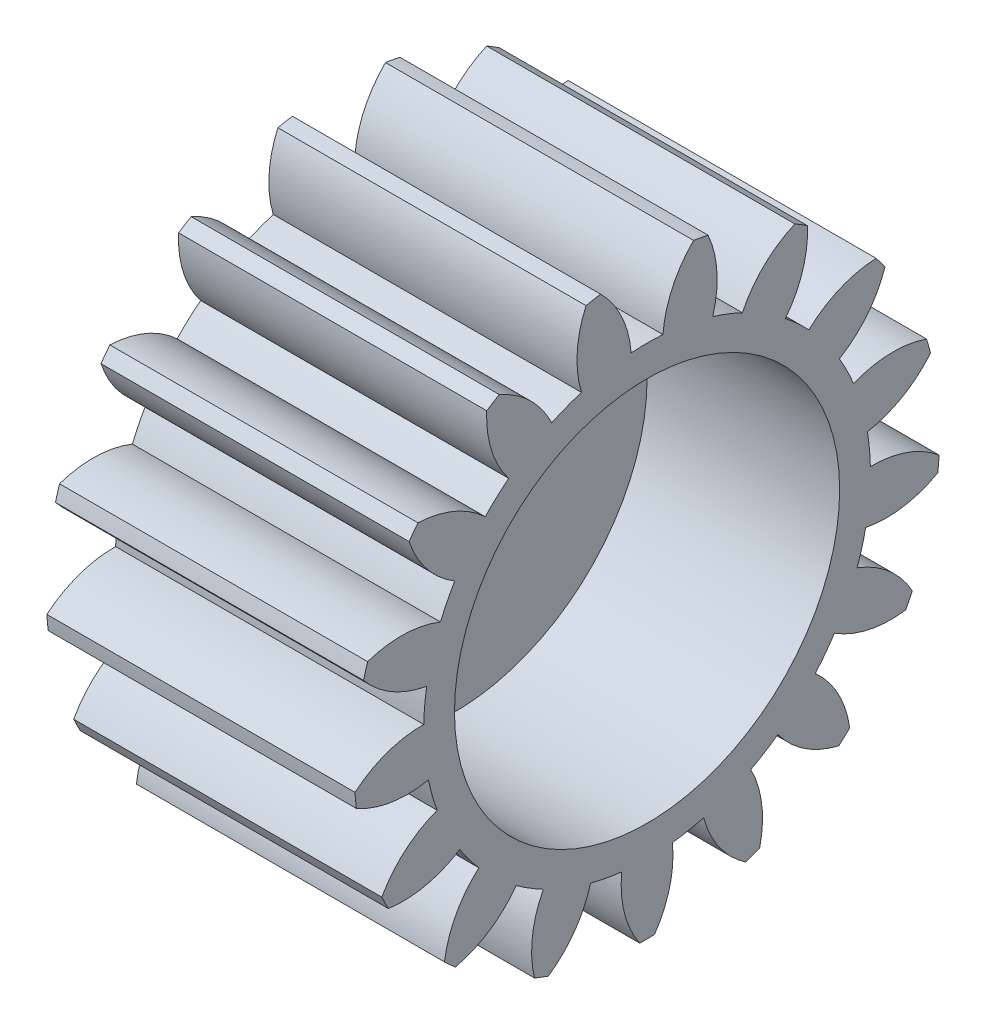
from build123d import *

# Parameters (mm, degrees)
BASPROSKE_W         = 8
BASPROSKE_H         = 7.6
TOOTHCUT_DEPTH      = 14.39850738
TEETHCUTS_COUNT     = 17
TEETHCUTS_ANGLE     = 338.823529412
BORSKE_R            = 5
BORE_DEPTH          = 50.0000508
BOSS_EXTRUDE1_START = -3
SKETCH1_R           = 5
BOSS_EXTRUDE1_DEPTH = 3


with BuildPart() as part:
    # BasProSke → Base-Revolve (revolve)
    with BuildSketch(Plane(origin=(0, 0, 0), x_dir=(1, 0, 0), z_dir=(0, 1, 0)), mode=Mode.PRIVATE) as base_revolve_sk:
        with Locations((4, 3.8)):
            Rectangle(BASPROSKE_W, BASPROSKE_H)
    revolve(base_revolve_sk.sketch.rotate(Axis((-10, 0, 0), (1, 0, 0)), 180), axis=Axis((-10, 0, 0), (1, 0, 0)))

    # TooCutSke → ToothCut (cut, through all)
    with BuildSketch(Plane(origin=(0, 0, 0), x_dir=(0, 0, -1), z_dir=(1, 0, 0))):
        with BuildLine():
            ThreePointArc((0.412875903, 5.784283403), (0, 5.799), (-0.412875903, 5.784283403))
            ThreePointArc((-0.412875903, 5.784283403), (-0.662486036, 6.729558143), (-1.230208712, 7.525510726))
            ThreePointArc((-1.230208712, 7.525510726), (0, 7.6254), (1.230208712, 7.525510726))
            ThreePointArc((1.230208712, 7.525510726), (0.662486036, 6.729558143), (0.412875903, 5.784283403))
        make_face()
    toothcut = extrude(amount=TOOTHCUT_DEPTH, mode=Mode.SUBTRACT)

    # TeethCuts: ToothCut ×17 about axis
    teethcuts_axis = Axis((-10, 0, 0), (1, 0, 0))
    for i in range(1, TEETHCUTS_COUNT):
        add(toothcut.rotate(teethcuts_axis, i * TEETHCUTS_ANGLE / (TEETHCUTS_COUNT - 1)), mode=Mode.SUBTRACT)

    # BorSke → Bore (cut, symmetric)
    with BuildSketch(Plane(origin=(0, 0, 0), x_dir=(0, 0, -1), z_dir=(1, 0, 0))):
        with Locations(Location((0, 0, 0), (0, 0, 180))):
            Circle(BORSKE_R)
    extrude(amount=BORE_DEPTH, both=True, mode=Mode.SUBTRACT)

    # Sketch1 → Boss-Extrude1 (add)
    with BuildSketch(Plane.ZY.offset(BOSS_EXTRUDE1_START)):
        Circle(SKETCH1_R)
    extrude(amount=BOSS_EXTRUDE1_DEPTH)


solid = part.part
